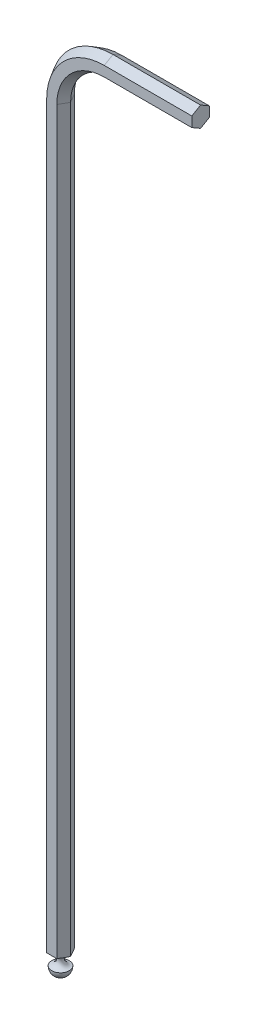
from build123d import *


with BuildPart() as part:
    # Austragung4: sweep along a path in Skizze1
    with BuildLine(Plane.XY) as austragung4_path:
        Line((0, 0), (0, 86))
        ThreePointArc((0, 86), (1.7573593128807152, 90.24264068711929), (6, 92.00000000000001))
        Line((6, 92.00000000000001), (16, 92))
    # Skizze3 → Austragung4 (sweep)
    with BuildSketch(Plane(origin=(0, 0, 0), x_dir=(1, 0, 0), z_dir=(0, 1, 0))):
        Polygon((-0.5773502691896251, 1), (-1.1547005383792512, -1.7e-16), (-0.577350269189625, -1.0000000000000009), (0.5773502691896264, -1.0000000000000007), (1.1547005383792524, -2.9e-16), (0.5773502691896265, 1), align=None)
    sweep(path=austragung4_path.line)

    # Skizze6 → Rotation5 (revolve)
    with BuildSketch(Plane(origin=(0, 0, 0), x_dir=(0, 0, -1), z_dir=(1, 0, 0))):
        with BuildLine():
            Line((1.08e-15, -1.0000000000000007), (1.08e-15, 1.0000000000000007))
            ThreePointArc((1.08e-15, 1.0000000000000007), (1.0000000000000007, 0), (1.08e-15, -1.0000000000000007))
        make_face()
    revolve(axis=Axis((0, 7.810357944094903, -1.48e-15), (0, -1, 0)))

    # Skizze8 → Schnitt-Rotation1 (revolve, cut)
    with BuildSketch(Plane.XY, mode=Mode.PRIVATE) as schnitt_rotation1_sk:
        with BuildLine():
            Line((-3.0586465116527903, -0.25356146909949984), (-1.1547005383792512, 0))
            ThreePointArc((-1.1547005383792512, 0), (-0.33900397376978075, 0.6461318381885482), (-0.9758944689717856, 1.469064238181372))
            Line((-0.9758944689717856, 1.469064238181372), (-3.0586465116527903, 1.7464385309005002))
            Line((-3.0586465116527903, 1.7464385309005002), (-3.0586465116527903, -0.25356146909949984))
        make_face()
    revolve(schnitt_rotation1_sk.sketch.rotate(Axis((0, 0, 0), (0, 1, 0)), 270), axis=Axis((0, 0, 0), (0, 1, 0)), mode=Mode.SUBTRACT)


solid = part.part
